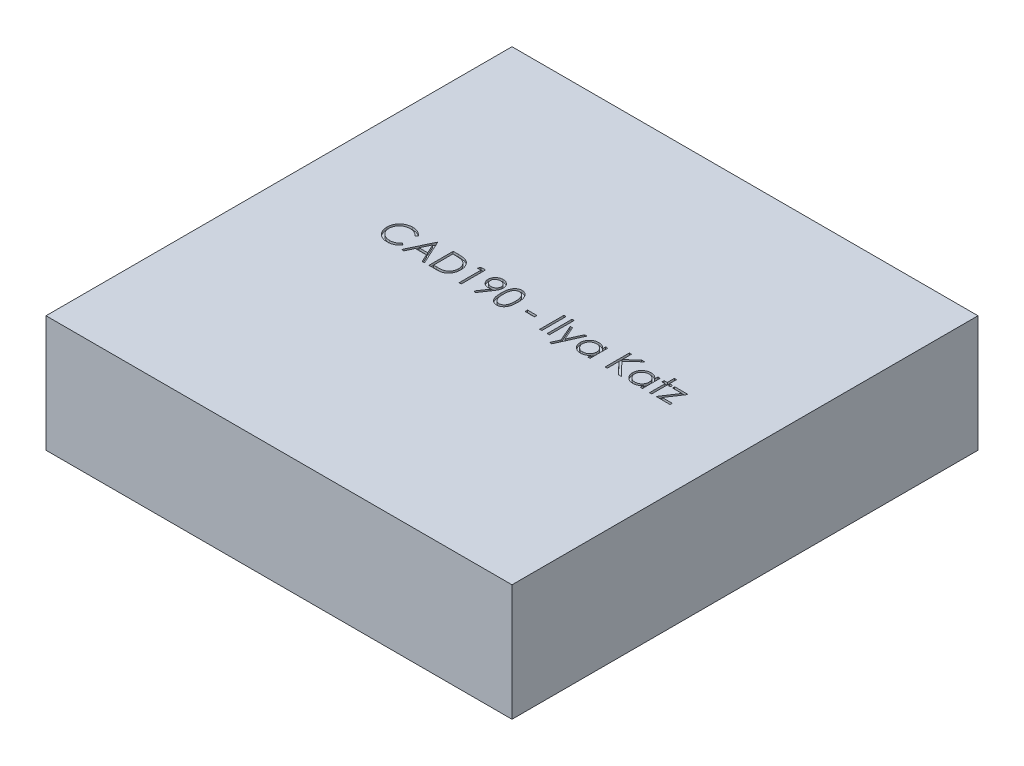
from build123d import *

# Parameters (mm, degrees)
SKETCH1_W           = 50.8
SKETCH1_H           = 50.8
BOSS_EXTRUDE1_DEPTH = 12.7
SKETCH2_W           = 1.017628205
SKETCH2_H           = 0.271367521
SKETCH2_W_2         = 0.237446582
SKETCH2_H_2         = 2.645833333
SKETCH2_W_3         = 0.237446581
SKETCH2_H_3         = 2.713675213
CUT_EXTRUDE1_DEPTH  = 0.254


with BuildPart() as part:
    # Sketch1 → Boss-Extrude1 (new body)
    with BuildSketch(Plane(origin=(0, 0, 0), x_dir=(1, 0, 0), z_dir=(0, 1, 0))):
        with Locations((25.4, -25.4)):
            Rectangle(SKETCH1_W, SKETCH1_H)
    extrude(amount=BOSS_EXTRUDE1_DEPTH)

    # Sketch2 → Cut-Extrude1 (cut)
    # profile 1 of 15: a face of its own
    with BuildSketch(Plane(origin=(0, 12.7, 0), x_dir=(1, 0, 0), z_dir=(0, 1, 0))):
        with BuildLine():
            Line((12.786199273, -23.008151584), (12.578433514, -23.167155991))
            add(Edge.make_bspline(
                [(12.578433514, -23.167155991), (12.563612396, -23.149492431), (12.534169981, -23.114403453), (12.486802608, -23.065130821), (12.437437675, -23.018968391), (12.386094054, -22.975696256), (12.331847577, -22.936827629), (12.27601233, -22.900336974), (12.217654284, -22.867628625), (12.136955056, -22.827969106), (12.031387933, -22.786583619), (11.898495406, -22.751882962), (11.759769754, -22.729793145), (11.66512633, -22.727400676), (11.616986866, -22.726183769)],
                knots=[0, 0, 0, 0, 0.757959112, 1.505699292, 2.245454638, 2.979532153, 3.711538275, 4.438200793, 5.171680507, 5.909471876, 7.393775596, 8.890124382, 10.418191784, 12, 12, 12, 12], degree=3))
            add(Edge.make_bspline(
                [(11.616986866, -22.726183769), (11.590465563, -22.726489145), (11.537669098, -22.727097064), (11.459315788, -22.735117058), (11.382425565, -22.746389222), (11.307048444, -22.763114913), (11.233280374, -22.784260881), (11.160639094, -22.809528902), (11.090176319, -22.840791192), (11.020917294, -22.87534446), (10.954560391, -22.91437235), (10.891774729, -22.956942562), (10.832789301, -23.002578724), (10.777557446, -23.051451882), (10.726022699, -23.103341936), (10.678558482, -23.158801884), (10.635329035, -23.21765442), (10.595477474, -23.279123484), (10.559786896, -23.343030029), (10.52990419, -23.409610588), (10.503441984, -23.477725), (10.482502676, -23.548142841), (10.465928785, -23.620368623), (10.454492992, -23.694596183), (10.446564207, -23.770670452), (10.445959312, -23.822233445), (10.445654401, -23.848224868)],
                knots=[0, 0, 0, 0, 1.054917814, 2.100044995, 3.131103042, 4.146048494, 5.169673617, 6.183595914, 7.203665975, 8.234915748, 9.262203917, 10.264457458, 11.251630812, 12.227803204, 13.197192746, 14.159520551, 15.12972552, 16.100847026, 17.073214652, 18.039054194, 19.002613845, 19.979014051, 20.95965708, 21.949030935, 22.966165397, 24, 24, 24, 24], degree=3))
            add(Edge.make_bspline(
                [(10.445654401, -23.848224868), (10.446608276, -23.887331283), (10.448481083, -23.96411154), (10.465148574, -24.076575037), (10.490476828, -24.18431388), (10.528437412, -24.286654594), (10.575245266, -24.384859127), (10.634391443, -24.477265879), (10.70289323, -24.565271258), (10.781719726, -24.646795391), (10.868205075, -24.721267077), (10.960996651, -24.786846385), (11.059863344, -24.841512993), (11.163713535, -24.887003143), (11.273346371, -24.921971026), (11.388564704, -24.946587953), (11.509117938, -24.96264603), (11.591493616, -24.964183401), (11.633417322, -24.96496582)],
                knots=[0, 0, 0, 0, 1.029171465, 2.020641659, 2.987623507, 3.938342917, 4.889210282, 5.84687017, 6.821220943, 7.821438502, 8.827599549, 9.822697543, 10.807740252, 11.797342354, 12.80366471, 13.83203677, 14.896651826, 16, 16, 16, 16], degree=3))
            add(Edge.make_bspline(
                [(11.633417322, -24.96496582), (11.679608045, -24.963689183), (11.770522438, -24.961176456), (11.903848267, -24.939889405), (12.031480066, -24.905374193), (12.1534247, -24.857070406), (12.269338391, -24.794277004), (12.379402533, -24.718154204), (12.48371003, -24.627977905), (12.546432368, -24.559123397), (12.578433514, -24.523993598)],
                knots=[0, 0, 0, 0, 1.028121516, 2.023589091, 2.998037872, 3.967518031, 4.937445131, 5.927275754, 6.942489185, 8, 8, 8, 8], degree=3))
            Line((12.578433514, -24.523993598), (12.786199273, -24.681407961))
            add(Edge.make_bspline(
                [(12.786199273, -24.681407961), (12.769479035, -24.702981672), (12.736118648, -24.746025756), (12.68209979, -24.806707346), (12.625193738, -24.863784802), (12.564977814, -24.916797944), (12.502144722, -24.96680757), (12.435566248, -25.012392883), (12.366117634, -25.054190158), (12.294034189, -25.092461702), (12.219392499, -25.126417002), (12.142282004, -25.15548622), (12.06303508, -25.180527059), (11.981648107, -25.201128225), (11.897952267, -25.217208152), (11.812249587, -25.227957549), (11.724355098, -25.235321972), (11.665057119, -25.235993194), (11.635007366, -25.236333342)],
                knots=[0, 0, 0, 0, 0.986787822, 1.968848986, 2.935600012, 3.899624008, 4.868462664, 5.837806735, 6.815139263, 7.798259679, 8.787526145, 9.778297419, 10.776456485, 11.791383307, 12.812564526, 13.85620153, 14.913611965, 16, 16, 16, 16], degree=3))
            add(Edge.make_bspline(
                [(11.635007366, -25.236333342), (11.606550546, -25.236135288), (11.550280709, -25.235743661), (11.467202486, -25.229399582), (11.386323458, -25.220744126), (11.307874782, -25.207711408), (11.23142836, -25.192332055), (11.157677204, -25.171716284), (11.085895587, -25.148622569), (11.016371901, -25.121480109), (10.949047009, -25.090851804), (10.884138056, -25.056235566), (10.821674896, -25.01792249), (10.761043417, -24.976757095), (10.703139291, -24.931417111), (10.647460733, -24.882532215), (10.593695528, -24.830267171), (10.560431594, -24.792579276), (10.543707119, -24.773630517)],
                knots=[0, 0, 0, 0, 1.114604814, 2.203992996, 3.262667896, 4.300477797, 5.318619304, 6.316056647, 7.298880507, 8.271930387, 9.238335007, 10.195173496, 11.151986948, 12.108099108, 13.064862484, 14.031167946, 15.010108607, 16, 16, 16, 16], degree=3))
            add(Edge.make_bspline(
                [(10.543707119, -24.773630517), (10.51691946, -24.740715452), (10.463667546, -24.6752827), (10.395536821, -24.569233179), (10.337216942, -24.458510188), (10.290063717, -24.342532027), (10.253201412, -24.221558943), (10.227664438, -24.095529953), (10.21107007, -23.964562758), (10.209172411, -23.875483757), (10.20820782, -23.830204369)],
                knots=[0, 0, 0, 0, 0.994628077, 1.977248131, 2.950237994, 3.925870899, 4.908910175, 5.911660606, 6.938484602, 8, 8, 8, 8], degree=3))
            add(Edge.make_bspline(
                [(10.20820782, -23.830204369), (10.209383472, -23.782613044), (10.211696495, -23.688980083), (10.231348078, -23.55156763), (10.262961097, -23.419917465), (10.307862316, -23.294275349), (10.364789576, -23.173980435), (10.435113266, -23.059951667), (10.518016403, -22.9514598), (10.612848791, -22.85015103), (10.716843145, -22.757517115), (10.828209153, -22.676020758), (10.946728839, -22.608198588), (11.071096501, -22.551505061), (11.202243415, -22.507928592), (11.339889772, -22.477423504), (11.483776927, -22.45843616), (11.581946737, -22.456035854), (11.631827278, -22.454816248)],
                knots=[0, 0, 0, 0, 1.032925535, 2.032216505, 3.007276963, 3.968222605, 4.92396291, 5.891752235, 6.871517503, 7.883894988, 8.900124299, 9.891468569, 10.874487609, 11.85992873, 12.854644235, 13.869047385, 14.917252991, 16, 16, 16, 16], degree=3))
            add(Edge.make_bspline(
                [(11.631827278, -22.454816248), (11.662227503, -22.455180721), (11.722401689, -22.45590216), (11.811417087, -22.46293716), (11.898081227, -22.474664708), (11.982453814, -22.490627451), (12.064945316, -22.510438938), (12.14492526, -22.536247378), (12.222862958, -22.565757137), (12.298266871, -22.599743596), (12.370775215, -22.637894049), (12.440365408, -22.679785622), (12.506484676, -22.72536638), (12.56959827, -22.774248661), (12.628650406, -22.827466619), (12.685317714, -22.883556469), (12.737675791, -22.944133824), (12.769995171, -22.986773268), (12.786199273, -23.008151584)],
                knots=[0, 0, 0, 0, 1.096760587, 2.17092713, 3.219439832, 4.250915756, 5.268269357, 6.278326846, 7.281116186, 8.274029601, 9.260640565, 10.235837813, 11.203064059, 12.156899882, 13.114053108, 14.069676657, 15.032185724, 16, 16, 16, 16], degree=3))
        make_face()
    # profile 2 of 15: a face of its own
    with BuildSketch(Plane(origin=(0, 12.7, 0), x_dir=(1, 0, 0), z_dir=(0, 1, 0))):
        Polygon((14.414404401, -22.522658128), (15.635558247, -25.168491461), (15.377441093, -25.168491461), (14.986290252, -24.320467957), (13.786867008, -24.320467957), (13.384585858, -25.168491461), (13.125408675, -25.168491461), (14.380483461, -22.522658128), align=None)
        Polygon((14.394793857, -23.038362422), (13.915660578, -24.049100436), (14.861206785, -24.049100436), align=None, mode=Mode.SUBTRACT)
    # profile 3 of 15: a face of its own
    with BuildSketch(Plane(origin=(0, 12.7, 0), x_dir=(1, 0, 0), z_dir=(0, 1, 0))):
        with BuildLine():
            Line((16.11045141, -25.168491461), (16.11045141, -22.522658128))
            Line((16.11045141, -22.522658128), (16.644706217, -22.522658128))
            add(Edge.make_bspline(
                [(16.644706217, -22.522658128), (16.691173845, -22.52299269), (16.780949061, -22.523639062), (16.910679899, -22.527737375), (17.030712862, -22.534987311), (17.140653178, -22.545547607), (17.240802666, -22.558514484), (17.330880899, -22.574767766), (17.41135365, -22.593960013), (17.46084543, -22.610322943), (17.484249486, -22.618060772)],
                knots=[0, 0, 0, 0, 1.314313732, 2.53924729, 3.670748893, 4.714932338, 5.66265055, 6.526160246, 7.303039223, 8, 8, 8, 8], degree=3))
            add(Edge.make_bspline(
                [(17.484249486, -22.618060772), (17.514861581, -22.629725651), (17.57539159, -22.652790888), (17.661575545, -22.696300711), (17.742708409, -22.74559871), (17.819225263, -22.800749868), (17.889378268, -22.863315774), (17.955908047, -22.93063869), (18.016092987, -23.005166781), (18.071208187, -23.085354421), (18.120901216, -23.170256984), (18.164095698, -23.259712691), (18.199968657, -23.353267247), (18.229748061, -23.450660484), (18.253217704, -23.552106555), (18.269230236, -23.657723585), (18.279791639, -23.767094163), (18.280853035, -23.841309382), (18.281391581, -23.87896572)],
                knots=[0, 0, 0, 0, 0.984719456, 1.947108742, 2.898477687, 3.838006223, 4.779231079, 5.722358779, 6.681677486, 7.655904652, 8.64651281, 9.637519902, 10.640069247, 11.656948941, 12.698408672, 13.768548281, 14.867775369, 16, 16, 16, 16], degree=3))
            add(Edge.make_bspline(
                [(18.281391581, -23.87896572), (18.280916111, -23.911669156), (18.279979149, -23.976114693), (18.271565916, -24.071093227), (18.259337388, -24.163254082), (18.240405167, -24.252158391), (18.217422315, -24.338585079), (18.187967272, -24.421613026), (18.154224962, -24.502003882), (18.114877733, -24.578670664), (18.071681567, -24.651305118), (18.025325249, -24.719775905), (17.975858223, -24.783105983), (17.922808786, -24.841487136), (17.866862477, -24.894831353), (17.807653013, -24.943584246), (17.745027611, -24.986791879), (17.679266767, -25.026152134), (17.608452074, -25.06048776), (17.531242223, -25.089539017), (17.44730794, -25.113613542), (17.356855246, -25.133699874), (17.259727855, -25.149633311), (17.155830542, -25.160312191), (17.045322936, -25.167533753), (16.969440991, -25.168166027), (16.930384135, -25.168491461)],
                knots=[0, 0, 0, 0, 1.105936401, 2.179363191, 3.223086493, 4.248585256, 5.251745608, 6.245858792, 7.225916811, 8.198733463, 9.158002045, 10.082870192, 10.993790845, 11.873723703, 12.748670949, 13.606408763, 14.465103618, 15.319838547, 16.196477973, 17.123216899, 18.106603292, 19.147568657, 20.255746949, 21.433717677, 22.679120308, 24, 24, 24, 24], degree=3))
            Line((16.930384135, -25.168491461), (16.11045141, -25.168491461))
        make_face()
        with BuildLine():
            Line((16.347897991, -24.89712394), (16.651596408, -24.89712394))
            add(Edge.make_bspline(
                [(16.651596408, -24.89712394), (16.695236308, -24.896936391), (16.779171816, -24.896575665), (16.899865659, -24.893410339), (17.010143536, -24.88823816), (17.110021106, -24.880999857), (17.199441975, -24.871422988), (17.278593024, -24.860745234), (17.347214797, -24.847442399), (17.388738836, -24.835384233), (17.407927371, -24.829812074)],
                knots=[0, 0, 0, 0, 1.375205317, 2.645023457, 3.804390687, 4.853969522, 5.800190428, 6.637939096, 7.370582563, 8, 8, 8, 8], degree=3))
            add(Edge.make_bspline(
                [(17.407927371, -24.829812074), (17.432078811, -24.821306432), (17.479804836, -24.804498305), (17.548506608, -24.773838644), (17.612578868, -24.737521127), (17.673138232, -24.697151551), (17.729325644, -24.651306061), (17.78180697, -24.600981564), (17.830476546, -24.545921942), (17.874831529, -24.486195534), (17.914525307, -24.422174082), (17.948899391, -24.354486987), (17.979025251, -24.283875887), (18.002670378, -24.209256463), (18.021202992, -24.131295806), (18.034329869, -24.04998843), (18.042505286, -23.965349521), (18.04345888, -23.907782141), (18.043944999, -23.878435705)],
                knots=[0, 0, 0, 0, 0.998632004, 1.973411704, 2.929992603, 3.868527914, 4.809262121, 5.754881198, 6.702106254, 7.672490631, 8.653608572, 9.636854334, 10.631411391, 11.644891563, 12.686317036, 13.754757253, 14.855430412, 16, 16, 16, 16], degree=3))
            add(Edge.make_bspline(
                [(18.043944999, -23.878435705), (18.043556979, -23.847491944), (18.042794708, -23.786702649), (18.033213533, -23.697507302), (18.019212119, -23.611721334), (17.998964928, -23.529339008), (17.973163609, -23.450199599), (17.940964088, -23.374740803), (17.904174441, -23.302165693), (17.860402276, -23.234149357), (17.812463107, -23.169823019), (17.759260782, -23.110892815), (17.70164055, -23.057224505), (17.640230872, -23.007982286), (17.573301041, -22.965147245), (17.502427715, -22.926830528), (17.426571166, -22.894312563), (17.373796093, -22.877017232), (17.346975682, -22.868227706)],
                knots=[0, 0, 0, 0, 1.122418816, 2.205001699, 3.251619955, 4.274784885, 5.280384055, 6.268708349, 7.249350384, 8.229342522, 9.199999885, 10.157847722, 11.105861043, 12.055065948, 13.010012805, 13.98527497, 14.976112212, 16, 16, 16, 16], degree=3))
            add(Edge.make_bspline(
                [(17.346975682, -22.868227706), (17.324787613, -22.862092073), (17.27760969, -22.849046034), (17.200623905, -22.834814949), (17.11398031, -22.822262738), (17.017294226, -22.81163553), (16.910675867, -22.804009995), (16.794043234, -22.798286442), (16.667345914, -22.794426071), (16.579517451, -22.794162465), (16.533933147, -22.794025649)],
                knots=[0, 0, 0, 0, 0.674548936, 1.434276114, 2.292660221, 3.240891867, 4.284742987, 5.42552168, 6.663806718, 8, 8, 8, 8], degree=3))
            Line((16.533933147, -22.794025649), (16.347897991, -22.794025649))
            Line((16.347897991, -22.794025649), (16.347897991, -24.89712394))
        make_face(mode=Mode.SUBTRACT)
    # profile 4 of 15: a face of its own
    with BuildSketch(Plane(origin=(0, 12.7, 0), x_dir=(1, 0, 0), z_dir=(0, 1, 0))):
        Polygon((19.149025628, -22.522658128), (19.638229187, -22.522658128), (19.638229187, -25.168491461), (19.400782606, -25.168491461), (19.400782606, -22.794025649), (18.993731324, -22.794025649), align=None)
    # profile 5 of 15: a face of its own
    with BuildSketch(Plane(origin=(0, 12.7, 0), x_dir=(1, 0, 0), z_dir=(0, 1, 0))):
        with BuildLine():
            Line((21.198592435, -25.236333342), (21.008847176, -25.104359684))
            Line((21.008847176, -25.104359684), (21.744507566, -24.028959877))
            add(Edge.make_bspline(
                [(21.744507566, -24.028959877), (21.697569927, -24.034699872), (21.605147098, -24.046002241), (21.512061312, -24.048078581), (21.466249854, -24.049100436)],
                knots=[0, 0, 0, 0, 1.015715272, 2, 2, 2, 2], degree=3))
            add(Edge.make_bspline(
                [(21.466249854, -24.049100436), (21.438474615, -24.048389027), (21.383954251, -24.046992593), (21.303799371, -24.035924083), (21.226778739, -24.01887726), (21.153096547, -23.993440404), (21.08247585, -23.961827829), (21.015070816, -23.922626396), (20.950972185, -23.876508545), (20.890868369, -23.823718129), (20.836204138, -23.765753172), (20.787503193, -23.704403371), (20.747028646, -23.63895606), (20.713406466, -23.57074631), (20.687907849, -23.498793742), (20.66933974, -23.423917112), (20.657907961, -23.345591644), (20.65654793, -23.292278004), (20.655857392, -23.265208709)],
                knots=[0, 0, 0, 0, 1.060718605, 2.082097864, 3.085795603, 4.069760067, 5.054557537, 6.03741023, 7.043284206, 8.066802108, 9.088538119, 10.083643548, 11.053783639, 12.022749082, 12.983451788, 13.964007469, 14.966251758, 16, 16, 16, 16], degree=3))
            add(Edge.make_bspline(
                [(20.655857392, -23.265208709), (20.657168543, -23.228190739), (20.659742064, -23.155531974), (20.680454039, -23.049370732), (20.714517509, -22.948990429), (20.76201277, -22.854654984), (20.821834851, -22.767721414), (20.893732417, -22.689398239), (20.977268151, -22.620799451), (21.070539083, -22.561832082), (21.171347616, -22.514407412), (21.276930471, -22.479452703), (21.386478645, -22.458891744), (21.460688729, -22.456181004), (21.498050735, -22.454816248)],
                knots=[0, 0, 0, 0, 1.022988612, 2.007919123, 2.978103895, 3.94594894, 4.918897164, 5.887013414, 6.875921846, 7.89917871, 8.930658928, 9.948724884, 10.967259574, 12, 12, 12, 12], degree=3))
            add(Edge.make_bspline(
                [(21.498050735, -22.454816248), (21.534705671, -22.456199764), (21.60713237, -22.458933461), (21.71363775, -22.478954081), (21.815646733, -22.51269728), (21.912593837, -22.559327873), (22.002355178, -22.617778797), (22.083072607, -22.687428109), (22.152904115, -22.768319193), (22.211735263, -22.858495611), (22.258959639, -22.955383745), (22.293032139, -23.05651802), (22.31400652, -23.161171101), (22.316649577, -23.232075257), (22.317983461, -23.267858782)],
                knots=[0, 0, 0, 0, 1.026385292, 2.028040595, 3.023318987, 4.028184125, 5.03290303, 6.015178782, 7.004435299, 8.016004309, 9.023023918, 10.015172535, 10.998308025, 12, 12, 12, 12], degree=3))
            add(Edge.make_bspline(
                [(22.317983461, -23.267858782), (22.31709264, -23.295635321), (22.315285832, -23.351973081), (22.302633981, -23.437569828), (22.281149674, -23.52484546), (22.256768926, -23.598718333), (22.23323449, -23.659730077), (22.211084229, -23.707923236), (22.186506589, -23.758648596), (22.157841808, -23.811374262), (22.127027453, -23.866772369), (22.092208833, -23.924287279), (22.054180217, -23.983996173), (22.027094655, -24.024248436), (22.013225014, -24.044860318)],
                knots=[0, 0, 0, 0, 1.179839688, 2.393009684, 3.667231171, 4.993948276, 5.694988576, 6.444077775, 7.246288328, 8.089075292, 8.993003841, 9.939041771, 10.944649915, 12, 12, 12, 12], degree=3))
            Line((22.013225014, -24.044860318), (21.198592435, -25.236333342))
        make_face()
        with BuildLine():
            add(Edge.make_bspline(
                [(21.510241073, -23.777732914), (21.531282262, -23.7771581), (21.572242305, -23.776039133), (21.632247763, -23.769228575), (21.688886893, -23.757153002), (21.742310992, -23.739826792), (21.793055733, -23.718919667), (21.8403151, -23.692301082), (21.884128645, -23.660538507), (21.924789757, -23.624849983), (21.960897066, -23.58519984), (21.993057572, -23.543700241), (22.020393239, -23.500169018), (22.041985716, -23.454061016), (22.059738937, -23.406498603), (22.071998981, -23.356715846), (22.07879071, -23.304972115), (22.079948507, -23.269821343), (22.08053688, -23.251958342)],
                knots=[0, 0, 0, 0, 1.163407946, 2.26475976, 3.333800367, 4.359385343, 5.366239384, 6.363380779, 7.350133999, 8.353570782, 9.349036268, 10.310270964, 11.253520213, 12.184142, 13.120487599, 14.056272588, 15.012232024, 16, 16, 16, 16], degree=3))
            add(Edge.make_bspline(
                [(22.08053688, -23.251958342), (22.080030642, -23.23408788), (22.079033038, -23.198871945), (22.071029543, -23.147051606), (22.056949761, -23.097390629), (22.038058145, -23.049617137), (22.013172013, -23.004123642), (21.983309259, -22.960338977), (21.947830562, -22.918540761), (21.907007193, -22.879712035), (21.862984644, -22.843919278), (21.816069861, -22.812330994), (21.766649538, -22.785856638), (21.715025179, -22.764010393), (21.661089225, -22.746962324), (21.604873591, -22.734702769), (21.546094207, -22.727920549), (21.506194068, -22.72677007), (21.485860397, -22.726183769)],
                knots=[0, 0, 0, 0, 0.972161553, 1.915763587, 2.844109794, 3.775983486, 4.705125789, 5.659731448, 6.655561913, 7.682237399, 8.721216875, 9.739758359, 10.754845918, 11.767244016, 12.7857855, 13.828538656, 14.893392813, 16, 16, 16, 16], degree=3))
            add(Edge.make_bspline(
                [(21.485860397, -22.726183769), (21.465703567, -22.726771017), (21.426156032, -22.727923192), (21.367899197, -22.734689877), (21.312063672, -22.747044773), (21.258283994, -22.764002496), (21.20666117, -22.785858267), (21.157243177, -22.812332382), (21.110317421, -22.843912007), (21.066337078, -22.879740198), (21.025441625, -22.918360026), (20.990572922, -22.960522082), (20.960641825, -23.004100865), (20.935789888, -23.04962319), (20.916889176, -23.097389013), (20.902811829, -23.147052043), (20.894807681, -23.198871831), (20.893810166, -23.234087842), (20.893303974, -23.251958342)],
                knots=[0, 0, 0, 0, 1.099389452, 2.15699305, 3.192601482, 4.213358962, 5.227959689, 6.245255729, 7.266013209, 8.307253147, 9.336162325, 10.327954924, 11.284637477, 12.215801273, 13.149702402, 14.080068371, 15.025723358, 16, 16, 16, 16], degree=3))
            add(Edge.make_bspline(
                [(20.893303974, -23.251958342), (20.893762025, -23.269835254), (20.894665386, -23.305091797), (20.903379846, -23.356894486), (20.917953308, -23.406551633), (20.937471537, -23.454546072), (20.96317512, -23.500411108), (20.994716363, -23.543929292), (21.031686627, -23.585593948), (21.073591704, -23.624757733), (21.119453944, -23.660704913), (21.168437199, -23.692099905), (21.219698206, -23.718613002), (21.273417415, -23.739886549), (21.329196722, -23.756979889), (21.387537447, -23.76920632), (21.44824665, -23.775973807), (21.489378005, -23.77714092), (21.510241073, -23.777732914)],
                knots=[0, 0, 0, 0, 0.952633368, 1.87876736, 2.791047057, 3.707742249, 4.635551637, 5.587206343, 6.568248508, 7.601284464, 8.641511608, 9.671105535, 10.699146789, 11.713763218, 12.747829548, 13.806491675, 14.887386225, 16, 16, 16, 16], degree=3))
        make_face(mode=Mode.SUBTRACT)
    # profile 6 of 15: a face of its own
    with BuildSketch(Plane(origin=(0, 12.7, 0), x_dir=(1, 0, 0), z_dir=(0, 1, 0))):
        with BuildLine():
            add(Edge.make_bspline(
                [(22.657192863, -23.846634824), (22.657440829, -23.80422787), (22.657922506, -23.721851751), (22.663281015, -23.601818123), (22.672182613, -23.489211238), (22.684381699, -23.384025706), (22.699227076, -23.286234372), (22.719044736, -23.196098573), (22.741581795, -23.113201133), (22.767701799, -23.037271727), (22.797174711, -22.967287392), (22.829252991, -22.901954055), (22.865209711, -22.841370571), (22.902989877, -22.784569979), (22.944122812, -22.732482067), (22.987437969, -22.684371245), (23.034625935, -22.641349427), (23.084082614, -22.602156092), (23.136255775, -22.567798455), (23.189658266, -22.537535611), (23.244657662, -22.51168214), (23.301404122, -22.491354251), (23.359387603, -22.474563909), (23.418810802, -22.463081787), (23.479771833, -22.45585722), (23.520919406, -22.45516653), (23.54178738, -22.454816248)],
                knots=[0, 0, 0, 0, 1.646270934, 3.197905019, 4.663502075, 6.030701355, 7.308322542, 8.50163776, 9.611534131, 10.641858119, 11.616356847, 12.558055219, 13.465016945, 14.349605745, 15.204443733, 16.039544428, 16.859896111, 17.680448484, 18.487036065, 19.28249412, 20.06191084, 20.843045899, 21.620316918, 22.403196591, 23.190181807, 24, 24, 24, 24], degree=3))
            add(Edge.make_bspline(
                [(23.54178738, -22.454816248), (23.562829677, -22.455185013), (23.604676183, -22.45591837), (23.66654361, -22.462966827), (23.726981762, -22.474662259), (23.785732974, -22.491233472), (23.843279839, -22.511792109), (23.899172242, -22.537560346), (23.953757358, -22.56755568), (24.006167754, -22.602801111), (24.056978802, -22.642097237), (24.104942441, -22.686519016), (24.150063035, -22.735617911), (24.192906867, -22.788868606), (24.23225842, -22.84729245), (24.269733574, -22.909873295), (24.30327672, -22.977705556), (24.3355821, -23.049657457), (24.363466905, -23.127719866), (24.388614603, -23.21145275), (24.408933823, -23.301845141), (24.425859047, -23.398422779), (24.438970962, -23.501540341), (24.448520638, -23.610976782), (24.453565172, -23.726804101), (24.454515179, -23.805996046), (24.455002692, -23.846634824)],
                knots=[0, 0, 0, 0, 0.810914788, 1.612654377, 2.396697861, 3.181598691, 3.963628158, 4.749916497, 5.551656086, 6.361998678, 7.18212741, 8.025565596, 8.878627764, 9.750805457, 10.657531673, 11.591944965, 12.560506719, 13.57287815, 14.630710178, 15.753379473, 16.941251878, 18.199788006, 19.531962791, 20.947069417, 22.433333509, 24, 24, 24, 24], degree=3))
            add(Edge.make_bspline(
                [(24.455002692, -23.846634824), (24.454510125, -23.88709635), (24.453550378, -23.965933982), (24.448577189, -24.081240136), (24.438781081, -24.1900958), (24.426527102, -24.292762042), (24.409555243, -24.388811552), (24.388687052, -24.4785767), (24.365516867, -24.562445136), (24.336915565, -24.639729785), (24.305611039, -24.711508766), (24.271551457, -24.778536908), (24.235061767, -24.841406665), (24.19530718, -24.899614807), (24.152933469, -24.953573672), (24.107033712, -25.002330804), (24.058901781, -25.047061014), (24.007941205, -25.086863137), (23.954713425, -25.121701055), (23.90031579, -25.152856763), (23.843783113, -25.177979098), (23.786396535, -25.199550231), (23.727335211, -25.216030334), (23.666672761, -25.227425451), (23.604717749, -25.235417265), (23.562836804, -25.236026925), (23.54178738, -25.236333342)],
                knots=[0, 0, 0, 0, 1.561518951, 3.042555995, 4.452378317, 5.7783523, 7.031515105, 8.214008947, 9.334062868, 10.386615937, 11.391082383, 12.354592575, 13.286541444, 14.194233754, 15.072674879, 15.931287219, 16.775624067, 17.606195743, 18.42308326, 19.229000347, 20.022332153, 20.807536673, 21.593273796, 22.3848459, 23.188221202, 24, 24, 24, 24], degree=3))
            add(Edge.make_bspline(
                [(23.54178738, -25.236333342), (23.520919985, -25.235980799), (23.479773554, -25.235285654), (23.418804161, -25.228093726), (23.359626361, -25.216531054), (23.301948136, -25.200341121), (23.245473568, -25.180523953), (23.190972209, -25.154705395), (23.137838067, -25.124970712), (23.086212903, -25.091107506), (23.037066805, -25.052310758), (22.990123216, -25.009399659), (22.946561446, -24.961303389), (22.906016623, -24.908781388), (22.86748264, -24.852316854), (22.832036507, -24.791138857), (22.799250206, -24.725489979), (22.769281615, -24.654946082), (22.742710899, -24.578477774), (22.71924031, -24.49521024), (22.700708775, -24.404408539), (22.68484666, -24.306801958), (22.672052632, -24.20197107), (22.663318112, -24.089858964), (22.657919618, -23.970535502), (22.657439535, -23.888688709), (22.657192863, -23.846634824)],
                knots=[0, 0, 0, 0, 0.810891512, 1.598919785, 2.382837074, 3.152667961, 3.926044502, 4.706494248, 5.493654104, 6.291793342, 7.103789334, 7.925228297, 8.761435821, 9.622817696, 10.50288917, 11.416980706, 12.369136599, 13.353924996, 14.394355917, 15.514179734, 16.714354668, 17.994756427, 19.357759367, 20.818452758, 22.365282078, 24, 24, 24, 24], degree=3))
        make_face()
        with BuildLine():
            add(Edge.make_bspline(
                [(22.894639444, -23.845574795), (22.89472974, -23.880914585), (22.894904987, -23.949502178), (22.899483187, -24.049169405), (22.905719969, -24.142129118), (22.913764283, -24.228499351), (22.92571056, -24.307987753), (22.939096048, -24.381141026), (22.955385378, -24.447572032), (22.974658397, -24.507736627), (22.996610572, -24.562655864), (23.020578695, -24.613759163), (23.046326979, -24.66165021), (23.075143242, -24.705898831), (23.106526653, -24.746649324), (23.139768343, -24.784622953), (23.176108927, -24.818487338), (23.22638259, -24.859102282), (23.292752544, -24.901072103), (23.37637634, -24.937619445), (23.462304276, -24.960587135), (23.520626948, -24.963507951), (23.549737601, -24.96496582)],
                knots=[0, 0, 0, 0, 1.459021318, 2.831673884, 4.118529203, 5.306027144, 6.411944654, 7.436330062, 8.375795394, 9.233974572, 10.042671642, 10.816086306, 11.563610507, 12.285937304, 12.993564865, 13.685989202, 14.367179055, 15.041617293, 16.353048772, 17.594441528, 18.799311195, 20, 20, 20, 20], degree=3))
            add(Edge.make_bspline(
                [(23.549737601, -24.96496582), (23.579036555, -24.963757974), (23.637573972, -24.961344775), (23.723097734, -24.938062397), (23.806124188, -24.902933638), (23.871190476, -24.86139594), (23.920692161, -24.821838215), (23.956159171, -24.788111665), (23.988712029, -24.750347408), (24.019586693, -24.709602107), (24.04790397, -24.665097313), (24.07365408, -24.617047033), (24.097151611, -24.565317833), (24.110538806, -24.529206185), (24.117383334, -24.510743231)],
                knots=[0, 0, 0, 0, 1.353760809, 2.704726607, 4.075137775, 5.516104923, 6.260822281, 7.007110065, 7.778089737, 8.566572457, 9.372053459, 10.217411131, 11.088608312, 12, 12, 12, 12], degree=3))
            add(Edge.make_bspline(
                [(24.117383334, -24.510743231), (24.125359968, -24.487135035), (24.141555956, -24.439200273), (24.162429142, -24.364842036), (24.178867629, -24.286825661), (24.193656602, -24.205617388), (24.203750876, -24.120618328), (24.211875711, -24.032091478), (24.216661409, -23.939970091), (24.217254643, -23.877381021), (24.21755611, -23.845574795)],
                knots=[0, 0, 0, 0, 0.884706709, 1.796334032, 2.740027952, 3.714592787, 4.726048262, 5.777819803, 6.87074269, 8, 8, 8, 8], degree=3))
            add(Edge.make_bspline(
                [(24.21755611, -23.845574795), (24.217140194, -23.813773713), (24.216326571, -23.751563999), (24.213216592, -23.660457994), (24.205185676, -23.573925817), (24.196266104, -23.491594686), (24.183114633, -23.41392035), (24.168934625, -23.34025256), (24.149883708, -23.271503964), (24.12953364, -23.206598208), (24.106242448, -23.146272714), (24.080603768, -23.09024622), (24.053221843, -23.038248244), (24.023480983, -22.990421449), (23.991734246, -22.94655161), (23.957143718, -22.907518315), (23.921081484, -22.872111798), (23.870570873, -22.831696641), (23.804444476, -22.790488395), (23.722162349, -22.75256547), (23.636535136, -22.730787772), (23.578649251, -22.72771733), (23.549737601, -22.726183769)],
                knots=[0, 0, 0, 0, 1.31362396, 2.569729283, 3.763502607, 4.902122613, 5.988968491, 7.01645872, 7.998833611, 8.933434873, 9.825090667, 10.667526885, 11.477055099, 12.250526234, 12.991942729, 13.710640831, 14.402115721, 15.076753259, 16.378508321, 17.609869233, 18.806226677, 20, 20, 20, 20], degree=3))
            add(Edge.make_bspline(
                [(23.549737601, -22.726183769), (23.520474237, -22.727719446), (23.461894197, -22.730793597), (23.375376993, -22.752484331), (23.292445728, -22.790291752), (23.226494193, -22.831833128), (23.175948354, -22.871398399), (23.14035608, -22.905708397), (23.106983676, -22.943238602), (23.076240832, -22.984363859), (23.047447147, -23.028560892), (23.021003167, -23.076177399), (22.997177567, -23.12745468), (22.975191043, -23.182349248), (22.955859233, -23.242508652), (22.939913201, -23.308857832), (22.925181917, -23.381778428), (22.91475335, -23.461697342), (22.905482535, -23.548089208), (22.899524611, -23.64128099), (22.894889673, -23.741115373), (22.894724524, -23.810057594), (22.894639444, -23.845574795)],
                knots=[0, 0, 0, 0, 1.207732386, 2.417664972, 3.655092373, 4.956220595, 5.625982001, 6.301752483, 6.994047911, 7.697131622, 8.419323945, 9.170223765, 9.943494443, 10.752040957, 11.610060368, 12.549350801, 13.567764191, 14.679664412, 15.874934091, 17.154273443, 18.533957287, 20, 20, 20, 20], degree=3))
        make_face(mode=Mode.SUBTRACT)
    # profile 7 of 15: a face of its own
    with BuildSketch(Plane(origin=(0, 12.7, 0), x_dir=(1, 0, 0), z_dir=(0, 1, 0))):
        with Locations((26.21889158, -24.150863257)):
            Rectangle(SKETCH2_W, SKETCH2_H)
    # profile 8 of 15: a face of its own
    with BuildSketch(Plane(origin=(0, 12.7, 0), x_dir=(1, 0, 0), z_dir=(0, 1, 0))):
        with Locations((28.305029401, -23.845574795)):
            Rectangle(SKETCH2_W_2, SKETCH2_H_2)
    # profile 9 of 15: a face of its own
    with BuildSketch(Plane(origin=(0, 12.7, 0), x_dir=(1, 0, 0), z_dir=(0, 1, 0))):
        with Locations((29.119131966, -23.811653855)):
            Rectangle(SKETCH2_W_3, SKETCH2_H_3)
    # profile 10 of 15: a face of its own
    with BuildSketch(Plane(origin=(0, 12.7, 0), x_dir=(1, 0, 0), z_dir=(0, 1, 0))):
        Polygon((29.577064657, -23.234997872), (29.833061753, -23.234997872), (30.487629895, -24.715858916), (31.152268317, -23.234997872), (31.408795427, -23.234997872), (30.221562521, -25.880831205), (29.965035411, -25.880831205), (30.358836325, -25.003656893), align=None)
    # profile 11 of 15: a face of its own
    with BuildSketch(Plane(origin=(0, 12.7, 0), x_dir=(1, 0, 0), z_dir=(0, 1, 0))):
        with BuildLine():
            Line((33.681498418, -23.234997872), (33.681498418, -25.168491461))
            Line((33.681498418, -25.168491461), (33.444051837, -25.168491461))
            Line((33.444051837, -25.168491461), (33.444051837, -24.834052192))
            add(Edge.make_bspline(
                [(33.444051837, -24.834052192), (33.417276918, -24.864320218), (33.365025327, -24.923388652), (33.277757339, -25.000557914), (33.185252823, -25.064343907), (33.087960753, -25.115861998), (32.985968986, -25.154560755), (32.87950361, -25.182066958), (32.768521197, -25.199751584), (32.692735191, -25.201517505), (32.654329949, -25.202412402)],
                knots=[0, 0, 0, 0, 1.074387032, 2.096679803, 3.090159297, 4.057316773, 5.018401886, 5.985159533, 6.978961417, 8, 8, 8, 8], degree=3))
            add(Edge.make_bspline(
                [(32.654329949, -25.202412402), (32.620185126, -25.201485322), (32.552850025, -25.199657082), (32.453798282, -25.185473673), (32.358478546, -25.162696358), (32.266800744, -25.131021281), (32.17935811, -25.089004827), (32.095401966, -25.038702812), (32.015367252, -24.978800518), (31.940473886, -24.910320282), (31.871506838, -24.835938357), (31.810984329, -24.756604521), (31.760522179, -24.672661827), (31.718324856, -24.585173074), (31.685821667, -24.493464772), (31.663163027, -24.397854055), (31.648996142, -24.298453972), (31.647168657, -24.230766357), (31.646242008, -24.19644452)],
                knots=[0, 0, 0, 0, 1.033919861, 2.038935746, 3.024066025, 3.998881131, 4.97069526, 5.957263378, 6.95902576, 7.993208707, 9.027059324, 10.027763471, 11.009749337, 11.988697705, 12.965288445, 13.950418724, 14.960734635, 16, 16, 16, 16], degree=3))
            add(Edge.make_bspline(
                [(31.646242008, -24.19644452), (31.647189195, -24.162832077), (31.649061732, -24.096382091), (31.663011487, -23.998653552), (31.686469452, -23.904523676), (31.719389551, -23.814295511), (31.76160341, -23.727859877), (31.812953809, -23.645155644), (31.873444457, -23.565954969), (31.943182884, -23.492120172), (32.018728811, -23.423917684), (32.099546721, -23.36464418), (32.183626225, -23.313453467), (32.272271477, -23.272893993), (32.364170419, -23.240078777), (32.460141179, -23.217375284), (32.559784456, -23.203996952), (32.627435006, -23.202059624), (32.661750154, -23.201076931)],
                knots=[0, 0, 0, 0, 1.020392517, 2.01726096, 2.990465484, 3.961182959, 4.928053699, 5.906110375, 6.912531644, 7.948652711, 8.985773172, 9.998621852, 10.987621588, 11.969261332, 12.953316658, 13.946091881, 14.958173133, 16, 16, 16, 16], degree=3))
            add(Edge.make_bspline(
                [(32.661750154, -23.201076931), (32.701210762, -23.202163803), (32.778591151, -23.204295107), (32.891778396, -23.222031812), (32.998854877, -23.251996605), (33.100647155, -23.292755666), (33.196789697, -23.346918694), (33.28637231, -23.415241641), (33.370332527, -23.497293609), (33.419000962, -23.560317695), (33.444051837, -23.592757787)],
                knots=[0, 0, 0, 0, 1.038897134, 2.037228247, 3.008116434, 3.962042015, 4.918381754, 5.904844433, 6.921570401, 8, 8, 8, 8], degree=3))
            Line((33.444051837, -23.592757787), (33.444051837, -23.234997872))
            Line((33.444051837, -23.234997872), (33.681498418, -23.234997872))
        make_face()
        with BuildLine():
            add(Edge.make_bspline(
                [(32.664930242, -23.438523513), (32.630221189, -23.439758465), (32.561711039, -23.442196064), (32.461136109, -23.461226028), (32.364893231, -23.492888787), (32.273463758, -23.536191176), (32.188291951, -23.590641471), (32.112172331, -23.656501089), (32.044482313, -23.731973117), (31.987552851, -23.816716974), (31.941144559, -23.907565888), (31.908512338, -24.002531982), (31.886990943, -24.099902411), (31.88479224, -24.165944441), (31.883688589, -24.199094593)],
                knots=[0, 0, 0, 0, 1.031046209, 2.035121221, 3.029706178, 4.034933723, 5.034054252, 6.02443088, 7.017295772, 8.038157696, 9.050218397, 10.03989886, 11.016116709, 12, 12, 12, 12], degree=3))
            add(Edge.make_bspline(
                [(31.883688589, -24.199094593), (31.88509836, -24.232046638), (31.887912375, -24.297821568), (31.908134626, -24.395324742), (31.942061673, -24.490313214), (31.988357756, -24.581980751), (32.046329193, -24.66708897), (32.113524781, -24.743999658), (32.190594339, -24.81013762), (32.275962157, -24.865501739), (32.36713604, -24.910225787), (32.463016452, -24.94134505), (32.561801012, -24.961436587), (32.628969145, -24.963783423), (32.662810184, -24.96496582)],
                knots=[0, 0, 0, 0, 0.979072187, 1.954306742, 2.945804271, 3.96968567, 4.997920485, 5.998718438, 6.996577872, 8.005894225, 9.015743152, 10.005417472, 10.995077863, 12, 12, 12, 12], degree=3))
            add(Edge.make_bspline(
                [(32.662810184, -24.96496582), (32.697165576, -24.963710967), (32.765495043, -24.961215187), (32.866368352, -24.942103754), (32.964260377, -24.910528532), (33.057837627, -24.866759549), (33.145011131, -24.812514405), (33.223250598, -24.749009045), (33.289408503, -24.67515009), (33.345494583, -24.593978605), (33.389472427, -24.504993941), (33.42150671, -24.410247261), (33.44044627, -24.309735267), (33.442833363, -24.241046465), (33.444051837, -24.205984784)],
                knots=[0, 0, 0, 0, 1.01762866, 2.023962475, 3.030623092, 4.058876274, 5.077231937, 6.066672613, 7.034107872, 8.005628644, 8.981990164, 9.965428785, 10.961468474, 12, 12, 12, 12], degree=3))
            add(Edge.make_bspline(
                [(33.444051837, -24.205984784), (33.443326382, -24.179271067), (33.441898458, -24.126690018), (33.430989635, -24.049486478), (33.413636804, -23.975604435), (33.389184639, -23.904966212), (33.357063252, -23.837962361), (33.318322381, -23.77411178), (33.272280761, -23.713746555), (33.219679557, -23.657697924), (33.16210229, -23.606575539), (33.101176656, -23.560943047), (33.036180817, -23.523456296), (32.968207819, -23.492431049), (32.897139727, -23.467742287), (32.822398246, -23.451271828), (32.744777822, -23.439962538), (32.691826339, -23.439008238), (32.664930242, -23.438523513)],
                knots=[0, 0, 0, 0, 1.050140795, 2.067009409, 3.05949893, 4.030605086, 5.00011959, 5.97591094, 6.962425594, 7.979863591, 8.993523472, 9.986985069, 10.967611495, 11.937549037, 12.921786183, 13.919465291, 14.943216303, 16, 16, 16, 16], degree=3))
        make_face(mode=Mode.SUBTRACT)
    # profile 12 of 15: a face of its own
    with BuildSketch(Plane(origin=(0, 12.7, 0), x_dir=(1, 0, 0), z_dir=(0, 1, 0))):
        Polygon((35.309703546, -22.522658128), (35.547150128, -22.522658128), (35.547150128, -23.530216054), (36.650110698, -22.522658128), (36.988790085, -22.522658128), (35.68866405, -23.709891034), (37.090552905, -25.168491461), (36.774134135, -25.168491461), (35.547150128, -23.891686073), (35.547150128, -25.168491461), (35.309703546, -25.168491461), align=None)
    # profile 13 of 15: a face of its own
    with BuildSketch(Plane(origin=(0, 12.7, 0), x_dir=(1, 0, 0), z_dir=(0, 1, 0))):
        with BuildLine():
            Line((39.380216367, -23.234997872), (39.380216367, -25.168491461))
            Line((39.380216367, -25.168491461), (39.142769786, -25.168491461))
            Line((39.142769786, -25.168491461), (39.142769786, -24.834052192))
            add(Edge.make_bspline(
                [(39.142769786, -24.834052192), (39.115994867, -24.864320218), (39.063743275, -24.923388652), (38.976475287, -25.000557914), (38.883970772, -25.064343907), (38.786678702, -25.115861998), (38.684686934, -25.154560755), (38.578221559, -25.182066958), (38.467239146, -25.199751584), (38.39145314, -25.201517505), (38.353047897, -25.202412402)],
                knots=[0, 0, 0, 0, 1.074387032, 2.096679803, 3.090159297, 4.057316773, 5.018401886, 5.985159533, 6.978961417, 8, 8, 8, 8], degree=3))
            add(Edge.make_bspline(
                [(38.353047897, -25.202412402), (38.318903075, -25.201485322), (38.251567974, -25.199657082), (38.152516231, -25.185473673), (38.057196495, -25.162696358), (37.965518693, -25.131021281), (37.878076059, -25.089004827), (37.794119914, -25.038702812), (37.714085201, -24.978800518), (37.639191835, -24.910320282), (37.570224787, -24.835938357), (37.509702278, -24.756604521), (37.459240128, -24.672661827), (37.417042805, -24.585173074), (37.384539616, -24.493464772), (37.361880976, -24.397854055), (37.347714091, -24.298453972), (37.345886605, -24.230766357), (37.344959957, -24.19644452)],
                knots=[0, 0, 0, 0, 1.033919861, 2.038935746, 3.024066025, 3.998881131, 4.97069526, 5.957263378, 6.95902576, 7.993208707, 9.027059324, 10.027763471, 11.009749337, 11.988697705, 12.965288445, 13.950418724, 14.960734635, 16, 16, 16, 16], degree=3))
            add(Edge.make_bspline(
                [(37.344959957, -24.19644452), (37.345907143, -24.162832077), (37.34777968, -24.096382091), (37.361729436, -23.998653552), (37.385187401, -23.904523676), (37.4181075, -23.814295511), (37.460321359, -23.727859877), (37.511671758, -23.645155644), (37.572162406, -23.565954969), (37.641900832, -23.492120172), (37.71744676, -23.423917684), (37.798264669, -23.36464418), (37.882344174, -23.313453467), (37.970989426, -23.272893993), (38.062888368, -23.240078777), (38.158859128, -23.217375284), (38.258502404, -23.203996952), (38.326152955, -23.202059624), (38.360468103, -23.201076931)],
                knots=[0, 0, 0, 0, 1.020392517, 2.01726096, 2.990465484, 3.961182959, 4.928053699, 5.906110375, 6.912531644, 7.948652711, 8.985773172, 9.998621852, 10.987621588, 11.969261332, 12.953316658, 13.946091881, 14.958173133, 16, 16, 16, 16], degree=3))
            add(Edge.make_bspline(
                [(38.360468103, -23.201076931), (38.399928711, -23.202163803), (38.4773091, -23.204295107), (38.590496345, -23.222031812), (38.697572826, -23.251996605), (38.799365104, -23.292755666), (38.895507646, -23.346918694), (38.985090259, -23.415241641), (39.069050476, -23.497293609), (39.11771891, -23.560317695), (39.142769786, -23.592757787)],
                knots=[0, 0, 0, 0, 1.038897134, 2.037228247, 3.008116434, 3.962042015, 4.918381754, 5.904844433, 6.921570401, 8, 8, 8, 8], degree=3))
            Line((39.142769786, -23.592757787), (39.142769786, -23.234997872))
            Line((39.142769786, -23.234997872), (39.380216367, -23.234997872))
        make_face()
        with BuildLine():
            add(Edge.make_bspline(
                [(38.363648191, -23.438523513), (38.328939138, -23.439758465), (38.260428988, -23.442196064), (38.159854058, -23.461226028), (38.063611179, -23.492888787), (37.972181707, -23.536191176), (37.8870099, -23.590641471), (37.81089028, -23.656501089), (37.743200262, -23.731973117), (37.6862708, -23.816716974), (37.639862508, -23.907565888), (37.607230287, -24.002531982), (37.585708892, -24.099902411), (37.583510189, -24.165944441), (37.582406538, -24.199094593)],
                knots=[0, 0, 0, 0, 1.031046209, 2.035121221, 3.029706178, 4.034933723, 5.034054252, 6.02443088, 7.017295772, 8.038157696, 9.050218397, 10.03989886, 11.016116709, 12, 12, 12, 12], degree=3))
            add(Edge.make_bspline(
                [(37.582406538, -24.199094593), (37.583816308, -24.232046638), (37.586630324, -24.297821568), (37.606852575, -24.395324742), (37.640779622, -24.490313214), (37.687075705, -24.581980751), (37.745047142, -24.66708897), (37.81224273, -24.743999658), (37.889312288, -24.81013762), (37.974680106, -24.865501739), (38.065853988, -24.910225787), (38.161734401, -24.94134505), (38.260518961, -24.961436587), (38.327687094, -24.963783423), (38.361528132, -24.96496582)],
                knots=[0, 0, 0, 0, 0.979072187, 1.954306742, 2.945804271, 3.96968567, 4.997920485, 5.998718438, 6.996577872, 8.005894225, 9.015743152, 10.005417472, 10.995077863, 12, 12, 12, 12], degree=3))
            add(Edge.make_bspline(
                [(38.361528132, -24.96496582), (38.395883524, -24.963710967), (38.464212991, -24.961215187), (38.5650863, -24.942103754), (38.662978326, -24.910528532), (38.756555576, -24.866759549), (38.84372908, -24.812514405), (38.921968547, -24.749009045), (38.988126451, -24.67515009), (39.044212531, -24.593978605), (39.088190376, -24.504993941), (39.120224659, -24.410247261), (39.139164219, -24.309735267), (39.141551312, -24.241046465), (39.142769786, -24.205984784)],
                knots=[0, 0, 0, 0, 1.01762866, 2.023962475, 3.030623092, 4.058876274, 5.077231937, 6.066672613, 7.034107872, 8.005628644, 8.981990164, 9.965428785, 10.961468474, 12, 12, 12, 12], degree=3))
            add(Edge.make_bspline(
                [(39.142769786, -24.205984784), (39.142044331, -24.179271067), (39.140616407, -24.126690018), (39.129707584, -24.049486478), (39.112354752, -23.975604435), (39.087902588, -23.904966212), (39.055781201, -23.837962361), (39.01704033, -23.77411178), (38.97099871, -23.713746555), (38.918397505, -23.657697924), (38.860820239, -23.606575539), (38.799894604, -23.560943047), (38.734898766, -23.523456296), (38.666925768, -23.492431049), (38.595857676, -23.467742287), (38.521116195, -23.451271828), (38.44349577, -23.439962538), (38.390544288, -23.439008238), (38.363648191, -23.438523513)],
                knots=[0, 0, 0, 0, 1.050140795, 2.067009409, 3.05949893, 4.030605086, 5.00011959, 5.97591094, 6.962425594, 7.979863591, 8.993523472, 9.986985069, 10.967611495, 11.937549037, 12.921786183, 13.919465291, 14.943216303, 16, 16, 16, 16], degree=3))
        make_face(mode=Mode.SUBTRACT)
    # profile 14 of 15: a face of its own
    with BuildSketch(Plane(origin=(0, 12.7, 0), x_dir=(1, 0, 0), z_dir=(0, 1, 0))):
        Polygon((40.160397991, -22.454816248), (40.397844572, -22.454816248), (40.397844572, -23.234997872), (40.737053974, -23.234997872), (40.737053974, -23.472444453), (40.397844572, -23.472444453), (40.397844572, -25.168491461), (40.160397991, -25.168491461), (40.160397991, -23.472444453), (39.821188589, -23.472444453), (39.821188589, -23.234997872), (40.160397991, -23.234997872), align=None)
    # profile 15 of 15: a face of its own
    with BuildSketch(Plane(origin=(0, 12.7, 0), x_dir=(1, 0, 0), z_dir=(0, 1, 0))):
        Polygon((40.974500555, -23.234997872), (42.433100982, -23.234997872), (41.30840981, -24.93104488), (42.399180042, -24.93104488), (42.399180042, -25.168491461), (40.872737734, -25.168491461), (41.997958922, -23.472444453), (40.974500555, -23.472444453), align=None)
    extrude(amount=-CUT_EXTRUDE1_DEPTH, mode=Mode.SUBTRACT)


solid = part.part
